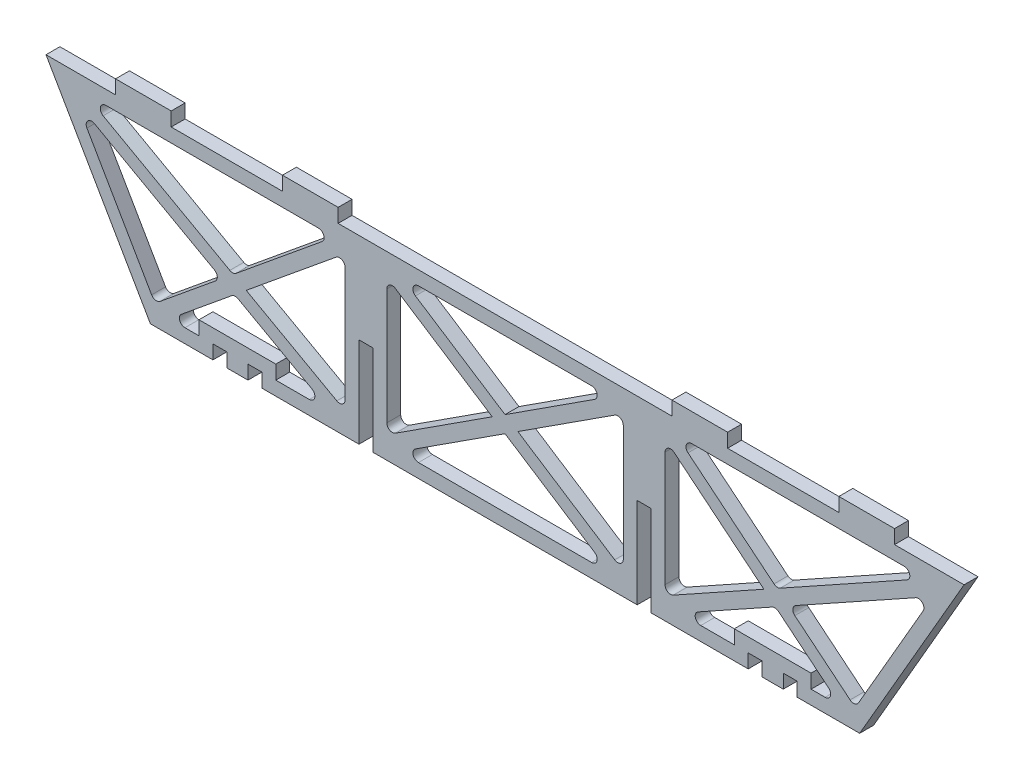
from build123d import *

# Parameters (mm, degrees)
EXTRUDE2_DEPTH = 6.35


with BuildPart() as part:
    # Sketch1 → Extrude2 (new body)
    with BuildSketch(Plane.XY):
        Polygon((47.660264722, 0), (76.2, 0), (76.2, 6.35), (82.55, 6.35), (82.55, 0), (92.202, 0), (92.202, 6.35), (98.552, 6.35), (98.552, 0), (142.875, 0), (142.875, 41.275), (149.225, 41.275), (149.225, 0), (209.55, 0), (269.875, 0), (269.875, 41.275), (276.225, 41.275), (276.225, 0), (320.548, 0), (320.548, 6.35), (326.898, 6.35), (326.898, 0), (336.55, 0), (336.55, 6.35), (342.9, 6.35), (342.9, 0), (371.439735278, 0), (419.1, 82.55), (387.35, 82.55), (387.35, 88.9), (361.95, 88.9), (361.95, 82.55), (311.15, 82.55), (311.15, 88.9), (285.75, 88.9), (285.75, 82.55), (209.55, 82.55), (133.35, 82.55), (133.35, 88.9), (107.95, 88.9), (107.95, 82.55), (57.15, 82.55), (57.15, 88.9), (31.75, 88.9), (31.75, 82.55), (0, 82.55), align=None)
        with BuildLine():
            Line((170.020448202, 6.35), (249.079551798, 6.35))
            ThreePointArc((249.079551798, 6.35), (251.515549625, 8.170615133), (250.459410045, 11.022508199))
            Line((250.459410045, 11.022508199), (209.55, 37.493302934))
            Line((209.55, 37.493302934), (168.640589955, 11.022508199))
            ThreePointArc((168.640589955, 11.022508199), (167.584450375, 8.170615133), (170.020448202, 6.35))
        make_face(mode=Mode.SUBTRACT)
        with BuildLine():
            Line((155.575, 14.800584131), (155.575, 67.749415869))
            ThreePointArc((155.575, 67.749415869), (156.901171335, 69.98060837), (159.494858247, 69.881924069))
            Line((159.494858247, 69.881924069), (203.70555908, 41.275))
            Line((203.70555908, 41.275), (159.494858247, 12.668075931))
            ThreePointArc((159.494858247, 12.668075931), (156.901171335, 12.56939163), (155.575, 14.800584131))
        make_face(mode=Mode.SUBTRACT)
        with BuildLine():
            Line((170.020448202, 76.2), (249.079551798, 76.2))
            ThreePointArc((249.079551798, 76.2), (251.515549625, 74.379384867), (250.459410045, 71.527491801))
            Line((250.459410045, 71.527491801), (209.55, 45.056697066))
            Line((209.55, 45.056697066), (168.640589955, 71.527491801))
            ThreePointArc((168.640589955, 71.527491801), (167.584450375, 74.379384867), (170.020448202, 76.2))
        make_face(mode=Mode.SUBTRACT)
        with BuildLine():
            Line((136.525, 14.303625696), (136.525, 66.727414853))
            ThreePointArc((136.525, 66.727414853), (135.071559028, 69.023278411), (132.374614584, 68.691659953))
            Line((132.374614584, 68.691659953), (91.396300636, 35.095608642))
            Line((91.396300636, 35.095608642), (132.749939536, 12.084115469))
            ThreePointArc((132.749939536, 12.084115469), (135.272351238, 12.114030576), (136.525, 14.303625696))
        make_face(mode=Mode.SUBTRACT)
        with BuildLine():
            Line((104.902, 6.35), (120.207049127, 6.35))
            ThreePointArc((120.207049127, 6.35), (122.665621474, 8.252017233), (121.442109591, 11.109510228))
            Line((121.442109591, 11.109510228), (87.625811497, 29.926802573))
            ThreePointArc((87.625811497, 29.926802573), (86.163798888, 30.2371328), (84.780365617, 29.671537445))
            Line((84.780365617, 29.671537445), (61.828236325, 10.8542451))
            ThreePointArc((61.828236325, 10.8542451), (61.046887793, 8.034892566), (63.438621741, 6.35))
            Line((63.438621741, 6.35), (69.85, 6.35))
            Line((69.85, 6.35), (69.85, 12.7))
            Line((69.85, 12.7), (104.902, 12.7))
            Line((104.902, 12.7), (104.902, 6.35))
        make_face(mode=Mode.SUBTRACT)
        with BuildLine():
            Line((18.683371551, 62.889451217), (48.221461062, 11.727979426))
            ThreePointArc((48.221461062, 11.727979426), (49.965843374, 10.499123351), (52.031551003, 11.033734326))
            Line((52.031551003, 11.033734326), (77.262001053, 31.718906867))
            ThreePointArc((77.262001053, 31.718906867), (78.181456091, 33.910104112), (76.886676101, 35.902662194))
            Line((76.886676101, 35.902662194), (22.118136541, 66.378961445))
            ThreePointArc((22.118136541, 66.378961445), (19.07288135, 65.941246674), (18.683371551, 62.889451217))
        make_face(mode=Mode.SUBTRACT)
        with BuildLine():
            Line((27.316473501, 76.2), (124.41281719, 76.2))
            ThreePointArc((124.41281719, 76.2), (126.804551138, 74.515107434), (126.023202606, 71.6957549))
            Line((126.023202606, 71.6957549), (86.766032084, 39.510782213))
            ThreePointArc((86.766032084, 39.510782213), (85.382598814, 38.945186859), (83.920586204, 39.255517086))
            Line((83.920586204, 39.255517086), (26.081413037, 71.440489772))
            ThreePointArc((26.081413037, 71.440489772), (24.857901154, 74.297982767), (27.316473501, 76.2))
        make_face(mode=Mode.SUBTRACT)
        with BuildLine():
            Line((331.474188503, 29.926802573), (297.657890409, 11.109510228))
            ThreePointArc((297.657890409, 11.109510228), (296.434378526, 8.252017233), (298.892950873, 6.35))
            Line((298.892950873, 6.35), (314.198, 6.35))
            Line((314.198, 6.35), (314.198, 12.7))
            Line((314.198, 12.7), (349.25, 12.7))
            Line((349.25, 12.7), (349.25, 6.35))
            Line((349.25, 6.35), (355.661378259, 6.35))
            ThreePointArc((355.661378259, 6.35), (358.053112207, 8.034892566), (357.271763675, 10.8542451))
            Line((357.271763675, 10.8542451), (334.319634383, 29.671537445))
            ThreePointArc((334.319634383, 29.671537445), (332.936201112, 30.2371328), (331.474188503, 29.926802573))
        make_face(mode=Mode.SUBTRACT)
        with BuildLine():
            Line((327.703699364, 35.095608642), (286.350060464, 12.084115469))
            ThreePointArc((286.350060464, 12.084115469), (283.827648762, 12.114030576), (282.575, 14.303625696))
            Line((282.575, 14.303625696), (282.575, 66.727414853))
            ThreePointArc((282.575, 66.727414853), (284.028440972, 69.023278411), (286.725385416, 68.691659953))
            Line((286.725385416, 68.691659953), (327.703699364, 35.095608642))
        make_face(mode=Mode.SUBTRACT)
        with BuildLine():
            Line((341.837998947, 31.718906867), (367.068448997, 11.033734326))
            ThreePointArc((367.068448997, 11.033734326), (369.134156626, 10.499123351), (370.878538938, 11.727979426))
            Line((370.878538938, 11.727979426), (400.416628449, 62.889451217))
            ThreePointArc((400.416628449, 62.889451217), (400.02711865, 65.941246674), (396.981863459, 66.378961445))
            Line((396.981863459, 66.378961445), (342.213323899, 35.902662194))
            ThreePointArc((342.213323899, 35.902662194), (340.918543909, 33.910104112), (341.837998947, 31.718906867))
        make_face(mode=Mode.SUBTRACT)
        with BuildLine():
            Line((259.605141753, 69.881924069), (215.39444092, 41.275))
            Line((215.39444092, 41.275), (259.605141753, 12.668075931))
            ThreePointArc((259.605141753, 12.668075931), (262.198828665, 12.56939163), (263.525, 14.800584131))
            Line((263.525, 14.800584131), (263.525, 67.749415869))
            ThreePointArc((263.525, 67.749415869), (262.198828665, 69.98060837), (259.605141753, 69.881924069))
        make_face(mode=Mode.SUBTRACT)
        with BuildLine():
            Line((293.076797394, 71.6957549), (332.333967916, 39.510782213))
            ThreePointArc((332.333967916, 39.510782213), (333.717401186, 38.945186859), (335.179413796, 39.255517086))
            Line((335.179413796, 39.255517086), (393.018586963, 71.440489772))
            ThreePointArc((393.018586963, 71.440489772), (394.242098846, 74.297982767), (391.783526499, 76.2))
            Line((391.783526499, 76.2), (294.68718281, 76.2))
            ThreePointArc((294.68718281, 76.2), (292.295448862, 74.515107434), (293.076797394, 71.6957549))
        make_face(mode=Mode.SUBTRACT)
    extrude(amount=EXTRUDE2_DEPTH)


solid = part.part
